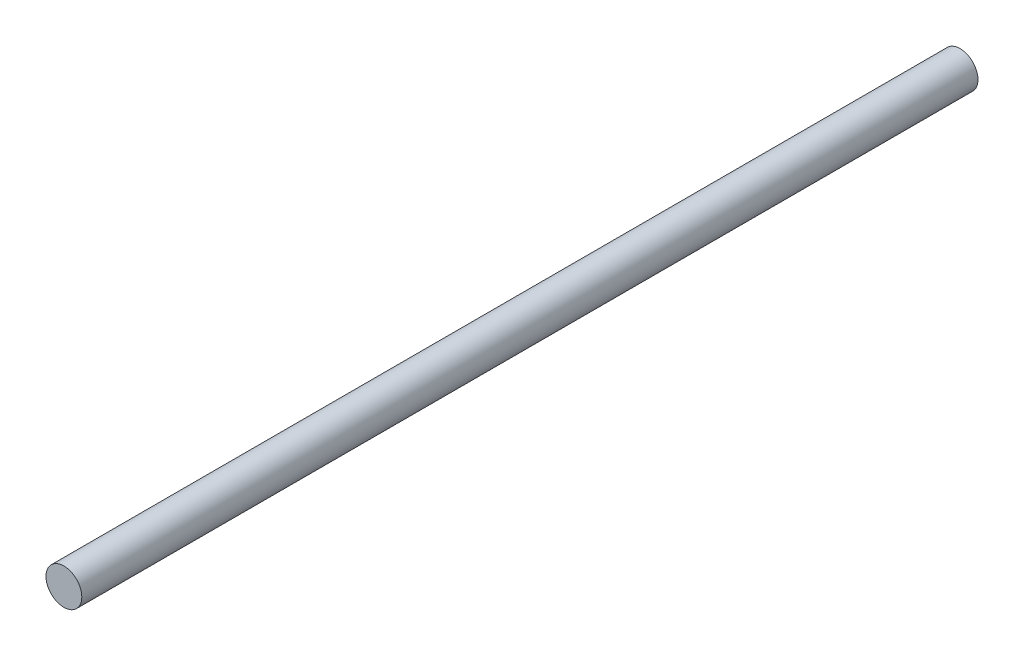
from build123d import *

# Parameters (mm, degrees)
EXTRUDE_START   = -100
SKETCH_10_R     = 4
EXTRUDE_1_DEPTH = 200


with BuildPart() as part:
    # 草图10 → 凸台-拉伸1 (new body)
    with BuildSketch(Plane.XY.offset(EXTRUDE_START)):
        Circle(SKETCH_10_R)
    extrude(amount=EXTRUDE_1_DEPTH)


solid = part.part
